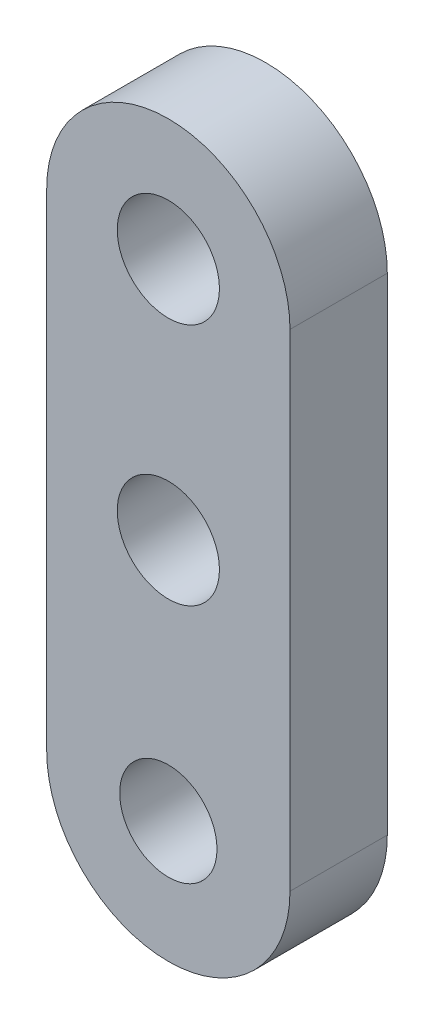
from build123d import *

# Parameters (mm, degrees)
SKETCH_1_R      = 1
SKETCH_1_R_2    = 1.05
EXTRUDE_1_DEPTH = 2


with BuildPart() as part:
    # 草图1 → 凸台-拉伸1 (new body)
    with BuildSketch(Plane.XY):
        with BuildLine():
            Line((-2.5, 0), (-2.5, 10))
            ThreePointArc((-2.5, 10), (0, 12.5), (2.5, 10))
            Line((2.5, 10), (2.5, 0))
            ThreePointArc((2.5, 0), (0, -2.5), (-2.5, 0))
        make_face()
        Circle(SKETCH_1_R, mode=Mode.SUBTRACT)
        with Locations((0, 10)):
            Circle(SKETCH_1_R_2, mode=Mode.SUBTRACT)
        with Locations((0, 5)):
            Circle(SKETCH_1_R_2, mode=Mode.SUBTRACT)
    extrude(amount=EXTRUDE_1_DEPTH)


solid = part.part
